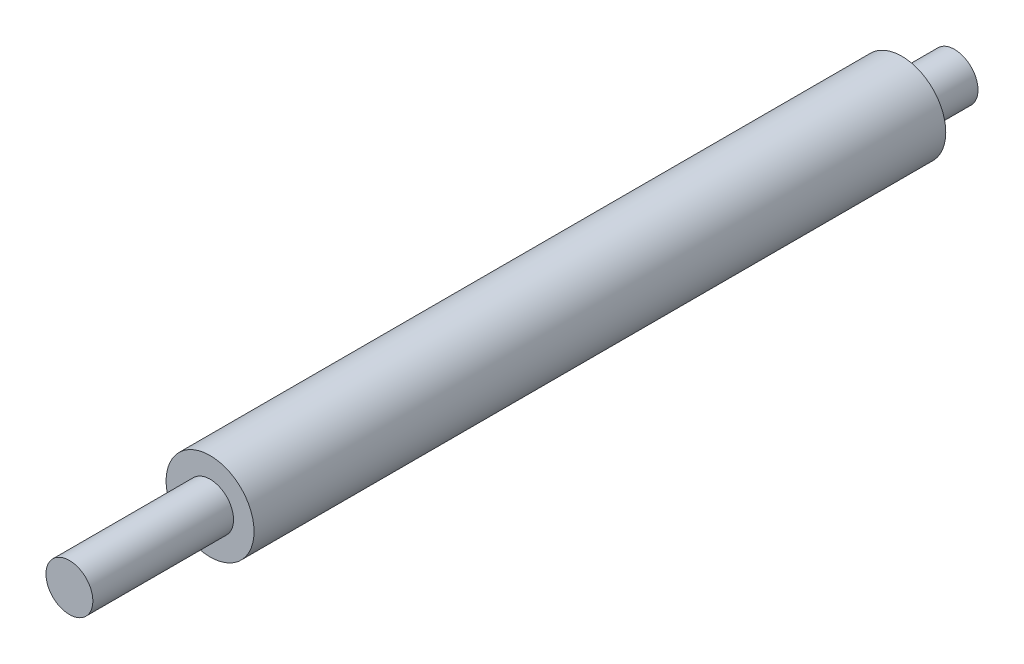
from build123d import *

# Parameters (mm, degrees)
SKETCH1_R           = 37.5
BOSS_EXTRUDE1_DEPTH = 295
SKETCH2_R           = 20
BOSS_EXTRUDE2_DEPTH = 120
BOSS_EXTRUDE3_START = 45
SKETCH3_R           = 20
BOSS_EXTRUDE3_DEPTH = 45


with BuildPart() as part:
    # Sketch1 → Boss-Extrude1 (new, symmetric)
    with BuildSketch(Plane.XY):
        Circle(SKETCH1_R)
    extrude(amount=BOSS_EXTRUDE1_DEPTH, both=True)

    # Sketch2 → Boss-Extrude2 (add)
    with BuildSketch(Plane.XY.offset(295)):
        Circle(SKETCH2_R)
    extrude(amount=BOSS_EXTRUDE2_DEPTH)

    # Sketch3 → Boss-Extrude3 (add)
    with BuildSketch(Plane(origin=(0, 0, -295), x_dir=(-1, 0, 0), z_dir=(0, 0, -1)).offset(BOSS_EXTRUDE3_START)):
        with Locations(Location((0, 0, 0), (0, 0, 180))):
            Circle(SKETCH3_R)
    extrude(amount=-BOSS_EXTRUDE3_DEPTH)


solid = part.part
